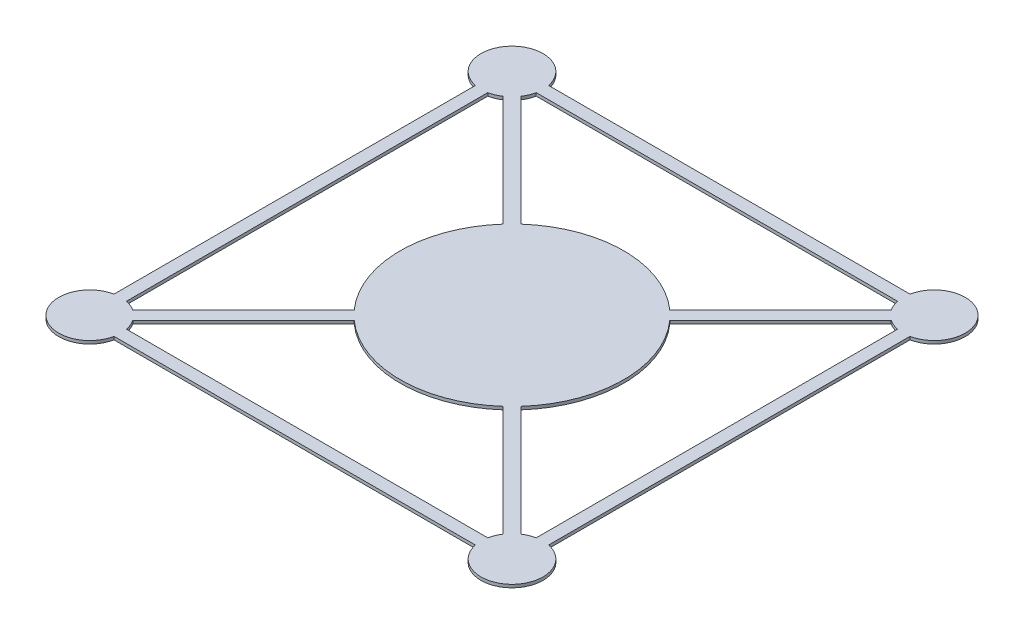
from build123d import *

# Parameters (mm, degrees)
BOSS_EXTRUDE1_DEPTH = 1.5748


with BuildPart() as part:
    # Sketch1 → Boss-Extrude1 (new body)
    with BuildSketch(Plane(origin=(0, 0, 0), x_dir=(1, 0, 0), z_dir=(0, 1, 0))):
        with BuildLine():
            Line((219.075, 15.554259867), (219.075, 200.345740133))
            ThreePointArc((219.075, 200.345740133), (227.125320151, 227.125320151), (200.345740133, 219.075))
            Line((200.345740133, 219.075), (15.554259867, 219.075))
            ThreePointArc((15.554259867, 219.075), (-11.225320151, 227.125320151), (-3.175, 200.345740133))
            Line((-3.175, 200.345740133), (-3.175, 15.554259867))
            ThreePointArc((-3.175, 15.554259867), (-11.225320151, -11.225320151), (15.554259867, -3.175))
            Line((15.554259867, -3.175), (200.345740133, -3.175))
            ThreePointArc((200.345740133, -3.175), (227.125320151, -11.225320151), (219.075, 15.554259867))
        make_face()
        with BuildLine():
            Line((15.554259867, 3.175), (200.345740133, 3.175))
            ThreePointArc((200.345740133, 3.175), (201.233412421, 6.075099489), (202.656413342, 8.753458598))
            Line((202.656413342, 8.753458598), (146.053677431, 65.356194509))
            ThreePointArc((146.053677431, 65.356194509), (107.95, 50.8), (69.846322569, 65.356194509))
            Line((69.846322569, 65.356194509), (13.243586658, 8.753458598))
            ThreePointArc((13.243586658, 8.753458598), (14.666587579, 6.075099489), (15.554259867, 3.175))
        make_face(mode=Mode.SUBTRACT)
        with BuildLine():
            Line((8.753458598, 13.243586658), (65.356194509, 69.846322569))
            ThreePointArc((65.356194509, 69.846322569), (50.8, 107.95), (65.356194509, 146.053677431))
            Line((65.356194509, 146.053677431), (8.753458598, 202.656413342))
            ThreePointArc((8.753458598, 202.656413342), (6.075099489, 201.233412421), (3.175, 200.345740133))
            Line((3.175, 200.345740133), (3.175, 15.554259867))
            ThreePointArc((3.175, 15.554259867), (6.075099489, 14.666587579), (8.753458598, 13.243586658))
        make_face(mode=Mode.SUBTRACT)
        with BuildLine():
            Line((212.725, 15.554259867), (212.725, 200.345740133))
            ThreePointArc((212.725, 200.345740133), (209.824900511, 201.233412421), (207.146541402, 202.656413342))
            Line((207.146541402, 202.656413342), (150.543805491, 146.053677431))
            ThreePointArc((150.543805491, 146.053677431), (165.1, 107.95), (150.543805491, 69.846322569))
            Line((150.543805491, 69.846322569), (207.146541402, 13.243586658))
            ThreePointArc((207.146541402, 13.243586658), (209.824900511, 14.666587579), (212.725, 15.554259867))
        make_face(mode=Mode.SUBTRACT)
        with BuildLine():
            Line((15.554259867, 212.725), (200.345740133, 212.725))
            ThreePointArc((200.345740133, 212.725), (201.233412421, 209.824900511), (202.656413342, 207.146541402))
            Line((202.656413342, 207.146541402), (146.053677431, 150.543805491))
            ThreePointArc((146.053677431, 150.543805491), (107.95, 165.1), (69.846322569, 150.543805491))
            Line((69.846322569, 150.543805491), (13.243586658, 207.146541402))
            ThreePointArc((13.243586658, 207.146541402), (14.666587579, 209.824900511), (15.554259867, 212.725))
        make_face(mode=Mode.SUBTRACT)
    extrude(amount=BOSS_EXTRUDE1_DEPTH)


solid = part.part
